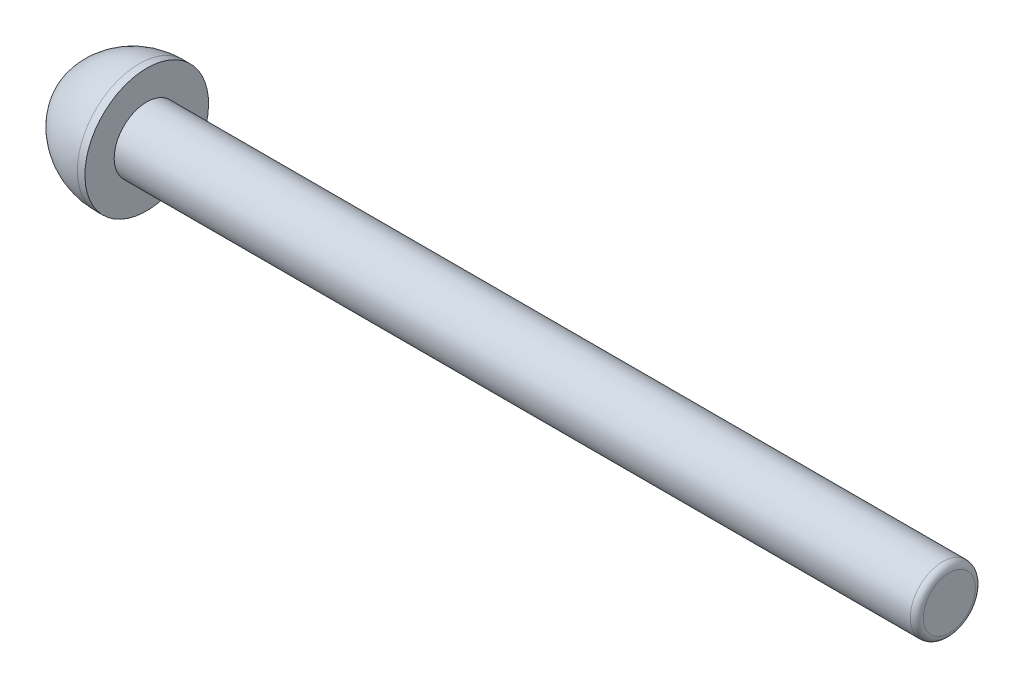
from build123d import *

# Parameters (mm, degrees)
CONG_1_R                = 0.3
ENL_V_MAT_EXTRU_1_DEPTH = 1


with BuildPart() as part:
    # Esquisse1 → Révolution1 (revolve)
    with BuildSketch(Plane.XY):
        with BuildLine():
            Line((40.164888985, 0), (0, 0))
            Line((0, 0), (0, 1.43))
            ThreePointArc((0, 1.43), (1.238500708, 2.474899998), (2.814888985, 2.85))
            Line((2.814888985, 2.85), (3.164888985, 2.85))
            Line((3.164888985, 2.85), (3.164888985, 1.5))
            Line((3.164888985, 1.5), (40.164888985, 1.5))
            Line((40.164888985, 1.5), (40.164888985, 0))
        make_face()
    revolve(axis=Axis((40.164888985, 0, 0), (-1, 0, 0)))

    # Congé1
    cong_1_edges = [part.edges().sort_by_distance(p)[0] for p in [
        (40.164888985, -1.5, 0),
    ]]
    fillet(cong_1_edges, radius=CONG_1_R)

    # Esquisse2 → Enlèv. mat.-Extru.1 (cut)
    with BuildSketch(Plane.ZY):
        Polygon((0, 1.154700538), (-1, 0.577350269), (-1, -0.577350269), (0, -1.154700538), (1, -0.577350269), (1, 0.577350269), align=None)
    extrude(amount=-ENL_V_MAT_EXTRU_1_DEPTH, mode=Mode.SUBTRACT)


solid = part.part
